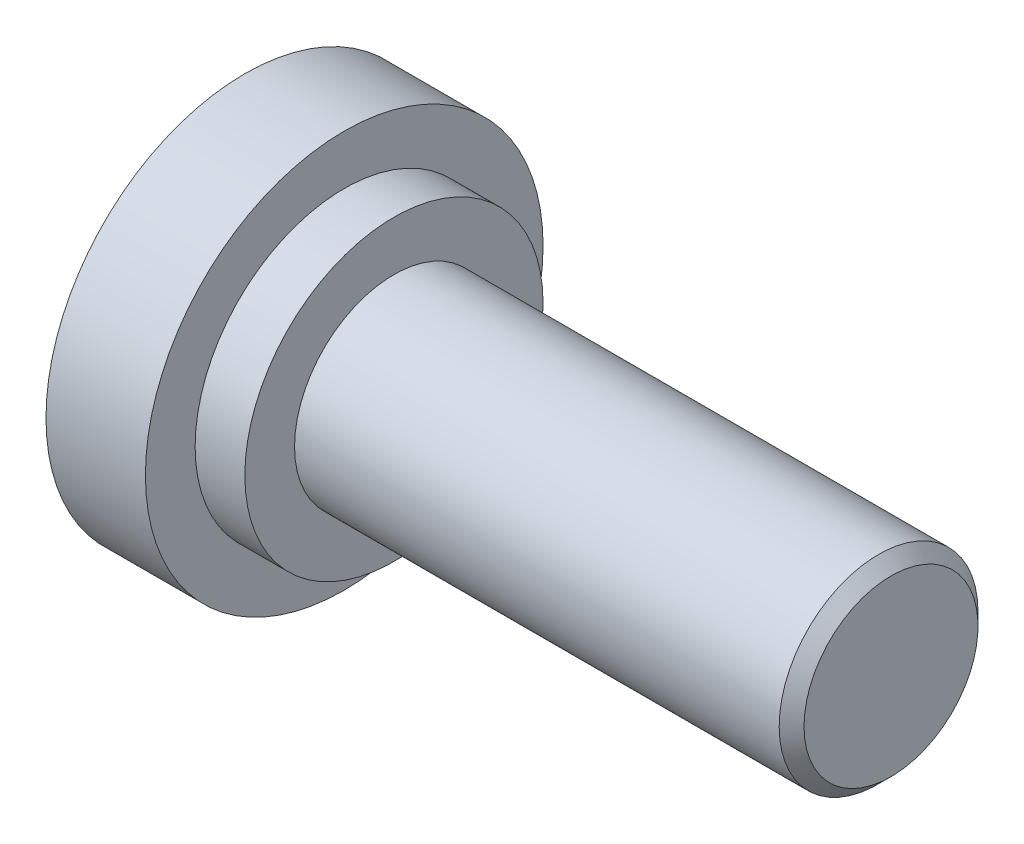
from build123d import *

# Parameters (mm, degrees)
CHANFREIN1_SIZE = 0.5


with BuildPart() as part:
    # Esquisse1 → Base-Révolution (revolve)
    with BuildSketch(Plane.XY, mode=Mode.PRIVATE) as base_r_volution_sk:
        Polygon((0, 0), (0, 8), (4, 8), (4, 6), (6, 6), (6, 4), (26, 4), (26, 0), align=None)
    revolve(base_r_volution_sk.sketch.rotate(Axis((-4.18019429, 0, 0), (1, 0, 0)), 90), axis=Axis((-4.18019429, 0, 0), (1, 0, 0)))

    # Chanfrein1
    chanfrein1_edges = [part.edges().sort_by_distance(p)[0] for p in [
        (26, 0, -4),
    ]]
    chamfer(chanfrein1_edges, length=CHANFREIN1_SIZE)


solid = part.part
